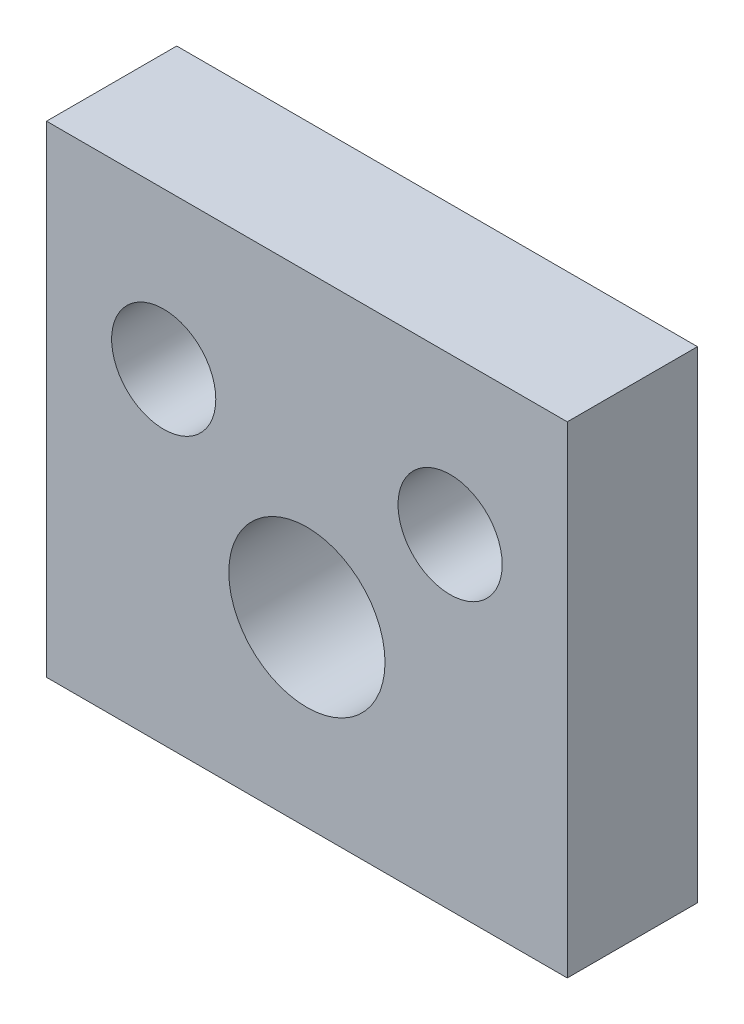
from build123d import *

# Parameters (mm, degrees)
ESQUISSE1_W      = 20
ESQUISSE1_H      = 18.5
ESQUISSE1_R      = 3
ESQUISSE1_R_2    = 2
EXTRUSION1_DEPTH = 5


with BuildPart() as part:
    # Esquisse1 → Extrusion1 (new body)
    with BuildSketch(Plane.XY):
        with Locations((-3.568212696, -1.818)):
            Rectangle(ESQUISSE1_W, ESQUISSE1_H)
        with Locations((-3.568212696, -4.068)):
            Circle(ESQUISSE1_R, mode=Mode.SUBTRACT)
        with Locations((-9.068212696, 1.432)):
            Circle(ESQUISSE1_R_2, mode=Mode.SUBTRACT)
        with Locations((1.931787304, 1.432)):
            Circle(ESQUISSE1_R_2, mode=Mode.SUBTRACT)
    extrude(amount=EXTRUSION1_DEPTH)


solid = part.part
